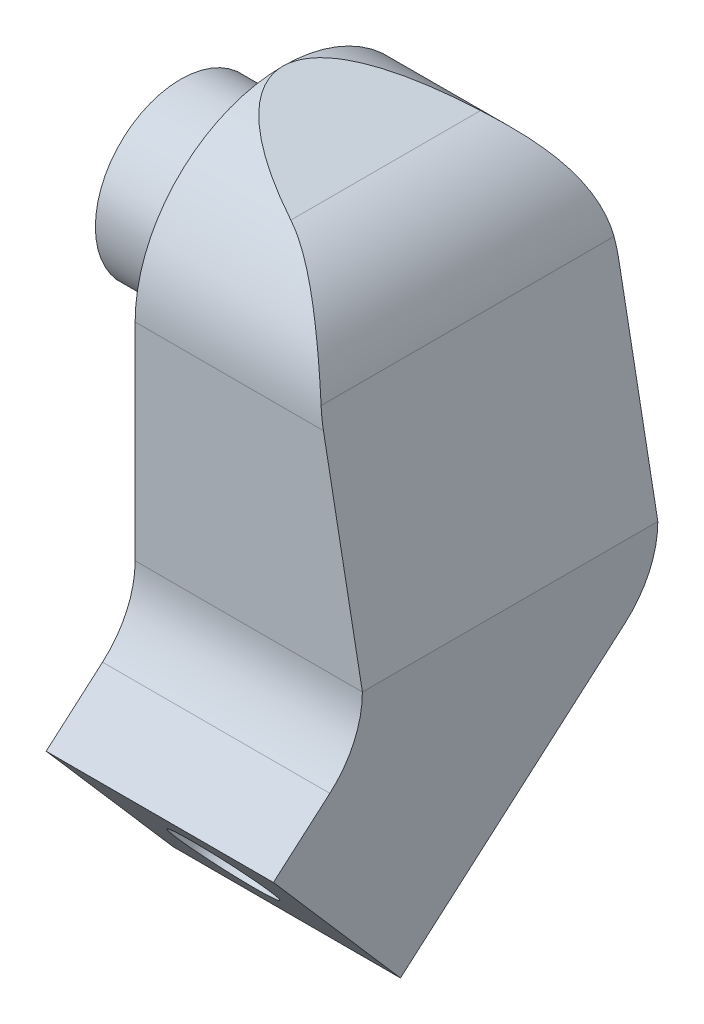
from build123d import *

# Parameters (mm, degrees)
SALIENTE_EXTRUIR1_DEPTH    = 6
CORTAR_EXTRUIR1_DEPTH      = 22.970816212
CORTAR_EXTRUIR1_DEPTH_BACK = 22.970816212
CORTAR_EXTRUIR2_DEPTH      = 34.249140271
CORTAR_EXTRUIR2_DEPTH_BACK = 5.4
CROQUIS4_R                 = 2.5
CROQUIS5_R                 = 4.5
SALIENTE_EXTRUIR2_DEPTH    = 5.4


with BuildPart() as part:
    # Croquis2 → Saliente-Extruir1 (new, symmetric)
    with BuildSketch(Plane(origin=(0, 0, 0), x_dir=(0, 0, -1), z_dir=(1, 0, 0))):
        with BuildLine():
            Line((7.8, 9.244722598), (7.8, -1.675439815))
            ThreePointArc((7.8, -1.675439815), (7.349392081, -3.749814828), (6.078787323, -5.450297917))
            Line((6.078787323, -5.450297917), (-5.789489169, -15.758911763))
            Line((-5.789489169, -15.758911763), (-12.497767664, -8.035690663))
            Line((-12.497767664, -8.035690663), (-9.521212677, -5.450297917))
            ThreePointArc((-9.521212677, -5.450297917), (-8.250607919, -3.749814828), (-7.8, -1.675439815))
            Line((-7.8, -1.675439815), (-7.8, 9.244722598))
            ThreePointArc((-7.8, 9.244722598), (0, 17.044722598), (7.8, 9.244722598))
        make_face()
    extrude(amount=SALIENTE_EXTRUIR1_DEPTH, both=True)

    # Croquis3 → Cortar-Extruir1 (cut, two sides: drawn at the far end of the back side and taken through both)
    with BuildSketch(Plane.XY.offset(-CORTAR_EXTRUIR1_DEPTH_BACK)):
        with BuildLine():
            Line((-6, 17.044722598), (-0.5698886, 15.224393056))
            ThreePointArc((-0.5698886, 15.224393056), (2.264862856, 13.331444594), (3.751873119, 10.264219435))
            Line((3.751873119, 10.264219435), (6, -1.675439815))
            Line((6, -1.675439815), (6, 17.044722598))
            Line((6, 17.044722598), (-6, 17.044722598))
        make_face()
    extrude(amount=CORTAR_EXTRUIR1_DEPTH + CORTAR_EXTRUIR1_DEPTH_BACK, mode=Mode.SUBTRACT)

    # Croquis4 → Cortar-Extruir2 (cut, two sides: drawn at the far end of the back side and taken through both)
    with BuildSketch(Plane(origin=(0, -9.642863705, 11.101800332), x_dir=(1, 0, 0), z_dir=(0, -0.6557574645123035, 0.7549716204841048)).offset(-CORTAR_EXTRUIR2_DEPTH_BACK)):
        with Locations(Location((0, -2.991213966, 0), (0, 0, 90))):
            Circle(CROQUIS4_R)
    extrude(amount=CORTAR_EXTRUIR2_DEPTH + CORTAR_EXTRUIR2_DEPTH_BACK, mode=Mode.SUBTRACT)

    # Croquis5 → Saliente-Extruir2 (add)
    with BuildSketch(Plane.ZY.offset(6)):
        with Locations(Location((0, 9.244722598, 0), (0, 0, 180))):
            Circle(CROQUIS5_R)
    extrude(amount=SALIENTE_EXTRUIR2_DEPTH)


solid = part.part
